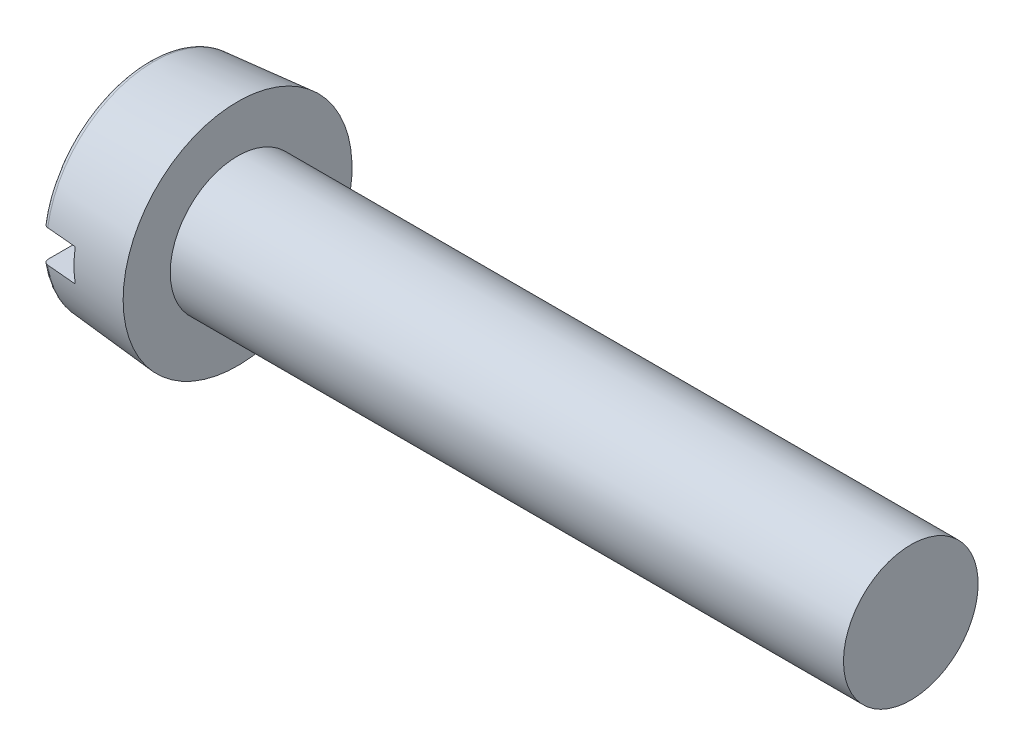
from build123d import *

# Parameters (mm, degrees)
FILLET2_R  = 0.2
SKETCH2_W  = 8.5
SKETCH2_H  = 1.2
SLOT_DEPTH = 1.3


with BuildPart() as part:
    # BodySke → Base-Revolve (revolve)
    with BuildSketch(Plane.XY, mode=Mode.PRIVATE) as base_revolve_sk:
        Polygon((3.3, 2.5), (3.3, 4.25), (0, 3.96128741), (0, 0), (28.3, 0), (28.3, 2.5), align=None)
    revolve(base_revolve_sk.sketch.rotate(Axis((-25.4, 0, 0), (1, 0, 0)), 90), axis=Axis((-25.4, 0, 0), (1, 0, 0)))

    # Fillet2
    fillet2_edges = [part.edges().sort_by_distance(p)[0] for p in [
        (0, 0, -3.96128741),
    ]]
    fillet(fillet2_edges, radius=FILLET2_R)

    # Sketch2 → Slot (cut)
    with BuildSketch(Plane(origin=(0, 0, 0), x_dir=(0, 0, -1), z_dir=(1, 0, 0))):
        Rectangle(SKETCH2_W, SKETCH2_H)
    extrude(amount=SLOT_DEPTH, mode=Mode.SUBTRACT)


solid = part.part
